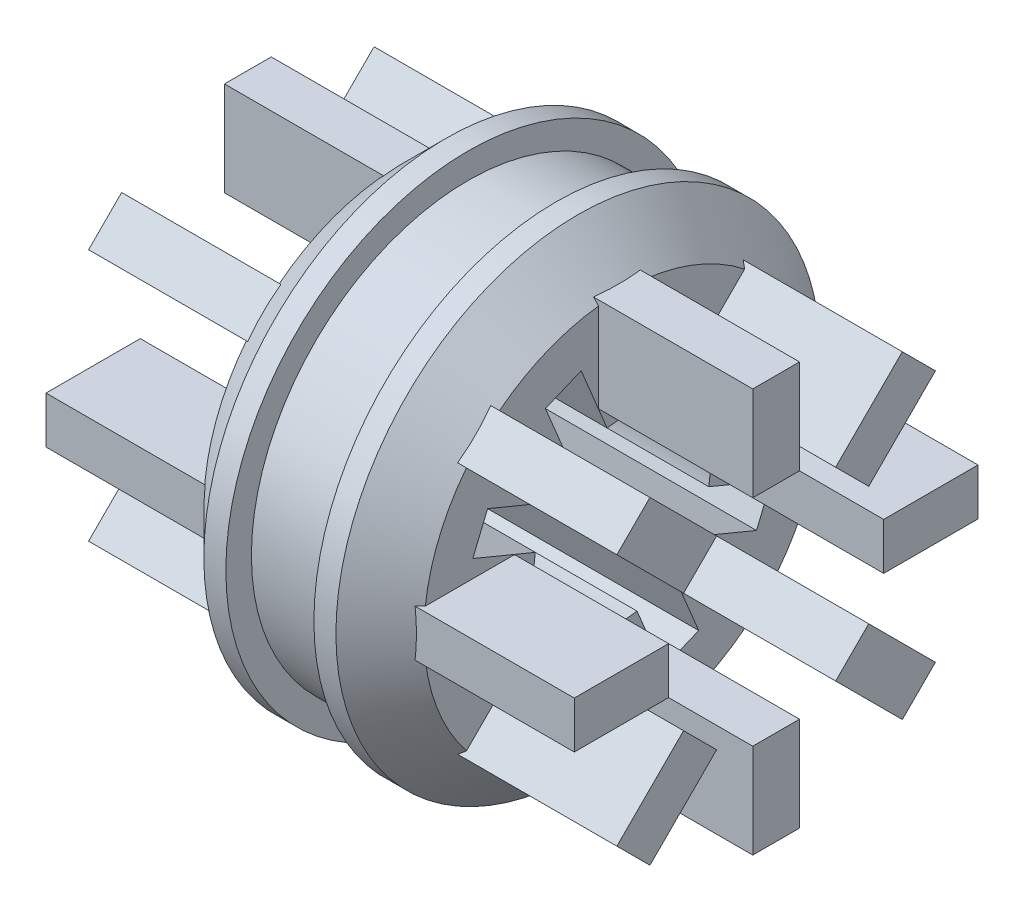
from build123d import *

# Parameters (mm, degrees)
SKETCH1_W               = 1.062231574
SKETCH1_H               = 2.14234413
SKETCH1_W_2             = 2.14234413
SKETCH1_H_2             = 1.062231574
BOSS_EXTRUDE3_DEPTH     = 6
CUT_EXTRUDE1_DEPTH      = 10.823441352
CUT_EXTRUDE1_DEPTH_BACK = 10.823441352


with BuildPart() as part:
    # Sketch3 → Revolve1 (revolve)
    with BuildSketch(Plane(origin=(0, 0, 0), x_dir=(1, 0, 0), z_dir=(0, 1, 0)), mode=Mode.PRIVATE) as revolve1_sk:
        Polygon((1, 5.5), (1.5, 5.5), (2.5, 4.5), (2.5, 2), (-2.5, 2), (-2.5, 4.5), (-1.5, 5.5), (-1, 5.5), (-1, 4.919351403), (1, 4.919351403), align=None)
    revolve(revolve1_sk.sketch.rotate(Axis((0, 0, 0), (1, 0, 0)), 180), axis=Axis((0, 0, 0), (1, 0, 0)))

    # Sketch1 → Boss-Extrude3 (add, symmetric)
    with BuildSketch(Plane(origin=(0, 0, 0), x_dir=(0, 0, -1), z_dir=(1, 0, 0))):
        Polygon((-3.617835313, -2.866724163), (-2.102969252, -1.351858102), (-1.351858102, -2.102969252), (-2.866724163, -3.617835313), align=None)
        with Locations((0, -3.514103914)):
            Rectangle(SKETCH1_W, SKETCH1_H)
        with Locations((-3.514103914, 0)):
            Rectangle(SKETCH1_W_2, SKETCH1_H_2)
        Polygon((-2.866724163, 3.617835313), (-1.351858102, 2.102969252), (-2.102969252, 1.351858102), (-3.617835313, 2.866724163), align=None)
        with Locations((0, 3.514103914)):
            Rectangle(SKETCH1_W, SKETCH1_H)
        Polygon((3.617835313, 2.866724163), (2.102969252, 1.351858102), (1.351858102, 2.102969252), (2.866724163, 3.617835313), align=None)
        with Locations((3.514103914, 0)):
            Rectangle(SKETCH1_W_2, SKETCH1_H_2)
        Polygon((2.866724163, -3.617835313), (1.351858102, -2.102969252), (2.102969252, -1.351858102), (3.617835313, -2.866724163), align=None)
    extrude(amount=BOSS_EXTRUDE3_DEPTH, both=True)

    # Sketch4 → Cut-Extrude1 (cut, two sides: drawn at the far end of the back side and taken through both)
    with BuildSketch(Plane(origin=(0, 0, 0), x_dir=(0, 0, -1), z_dir=(1, 0, 0)).offset(-CUT_EXTRUDE1_DEPTH_BACK)):
        Polygon((1.741274388, 3.054032834), (1.128980896, 1.575825582), (0.315966908, 1.912587003), (0.928260399, 3.390794255), align=None)
        Polygon((3.390794255, 0.928260399), (1.912587003, 0.315966908), (1.575825582, 1.128980896), (3.054032834, 1.741274388), align=None)
        Polygon((3.054032834, -1.741274388), (1.575825582, -1.128980896), (1.912587003, -0.315966908), (3.390794255, -0.928260399), align=None)
        Polygon((0.928260399, -3.390794255), (0.315966908, -1.912587003), (1.128980896, -1.575825582), (1.741274388, -3.054032834), align=None)
        Polygon((-1.741274388, -3.054032834), (-1.128980896, -1.575825582), (-0.315966908, -1.912587003), (-0.928260399, -3.390794255), align=None)
        Polygon((-3.390794255, -0.928260399), (-1.912587003, -0.315966908), (-1.575825582, -1.128980896), (-3.054032834, -1.741274388), align=None)
        Polygon((-3.054032834, 1.741274388), (-1.575825582, 1.128980896), (-1.912587003, 0.315966908), (-3.390794255, 0.928260399), align=None)
        Polygon((-0.928260399, 3.390794255), (-0.315966908, 1.912587003), (-1.128980896, 1.575825582), (-1.741274388, 3.054032834), align=None)
    extrude(amount=CUT_EXTRUDE1_DEPTH + CUT_EXTRUDE1_DEPTH_BACK, mode=Mode.SUBTRACT)


solid = part.part
